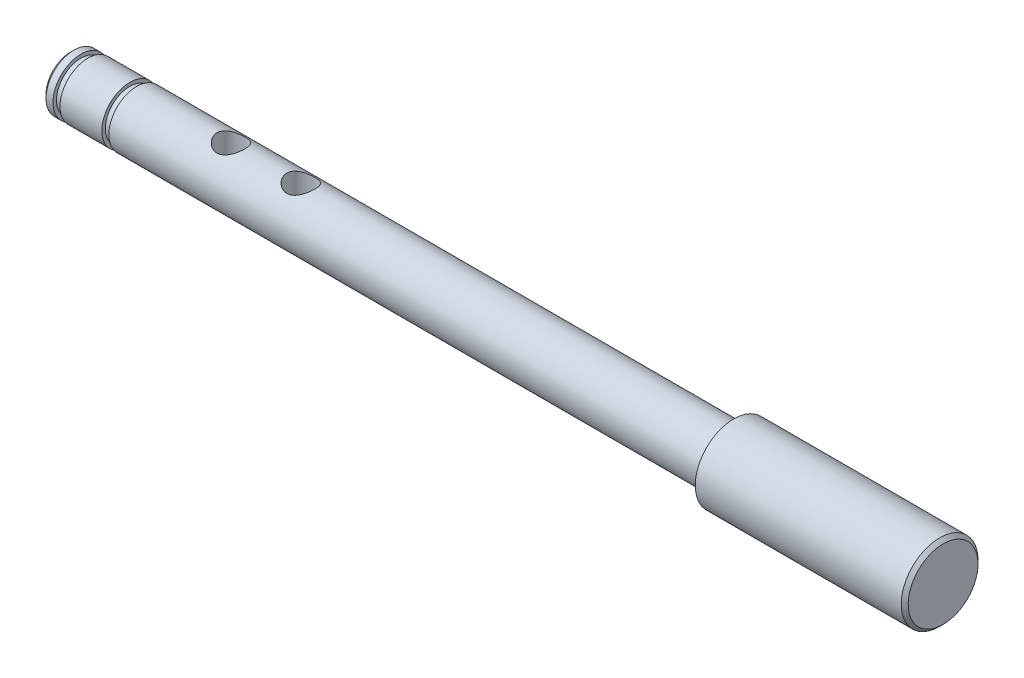
from build123d import *

# Parameters (mm, degrees)
CUT_EXTRUDE_1_DEPTH      = 10
CUT_EXTRUDE_1_DEPTH_BACK = 10
SKETCH_2_R               = 2


with BuildPart() as part:
    # 草图1 → 旋转1 (revolve)
    with BuildSketch(Plane.XY):
        with BuildLine():
            Line((-32.999870063, 0), (-32.999870063, 3.5))
            Line((-32.999870063, 3.5), (-32.499870063, 4))
            Line((-32.499870063, 4), (-31.499870063, 4))
            Line((-31.499870063, 4), (-31.499870063, 3.5))
            Line((-31.499870063, 3.5), (-30.499870063, 3.5))
            Line((-30.499870063, 3.5), (-30.499870063, 4))
            Line((-30.499870063, 4), (-24.499870063, 4))
            Line((-24.499870063, 4), (-24.499870063, 3.5))
            Line((-24.499870063, 3.5), (-23.499870063, 3.5))
            Line((-23.499870063, 3.5), (-23.499870063, 4))
            Line((-23.499870063, 4), (61, 4))
            ThreePointArc((61, 4), (61.707106781, 4.292893219), (62, 5))
            Line((62, 5), (62, 5.5))
            Line((62, 5.5), (91.5, 5.5))
            Line((91.5, 5.5), (92, 5))
            Line((92, 5), (92, 0))
            Line((92, 0), (-32.999870063, 0))
        make_face()
    revolve(axis=Axis((-32.999870063, 0, 0), (1, 0, 0)))

    # 草图2 → 切除-拉伸1 (cut, two sides: drawn at the far end of the back side and taken through both)
    with BuildSketch(Plane(origin=(0, 0, 0), x_dir=(1, 0, 0), z_dir=(0, 1, 0)).offset(-CUT_EXTRUDE_1_DEPTH_BACK)):
        with Locations((-9.999870063, 0)):
            Circle(SKETCH_2_R)
        with Locations((0.000129937, 0)):
            Circle(SKETCH_2_R)
    extrude(amount=CUT_EXTRUDE_1_DEPTH + CUT_EXTRUDE_1_DEPTH_BACK, mode=Mode.SUBTRACT)


solid = part.part
